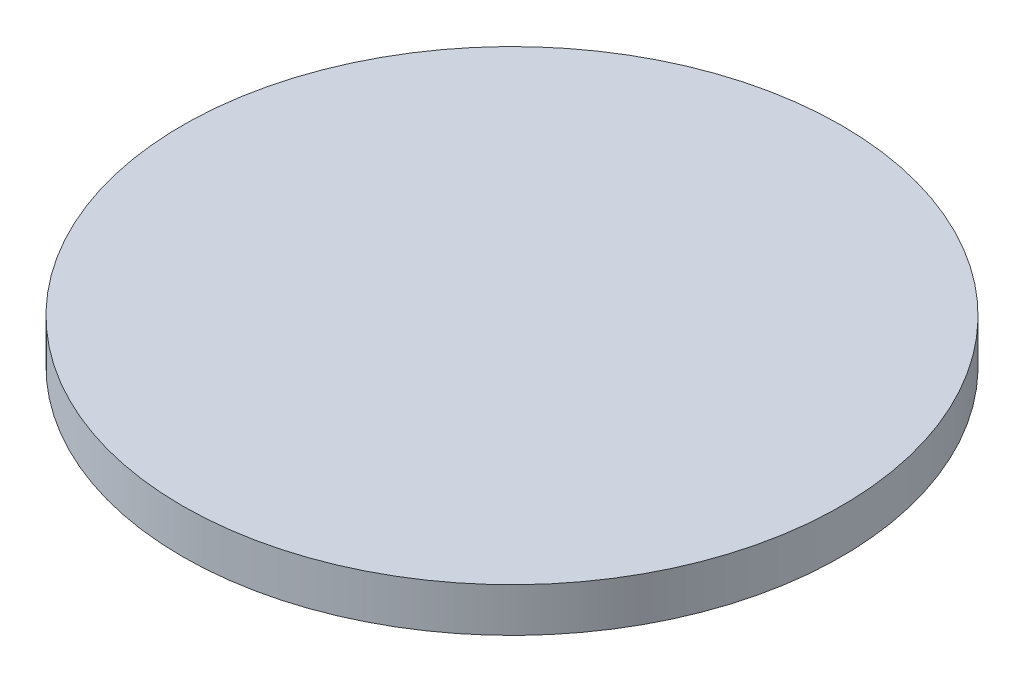
from build123d import *

# Parameters (mm, degrees)
CROQUIS3_R              = 225
SALIENTE_EXTRUIR2_DEPTH = 30
CROQUIS5_R              = 208.091282864
CORTAR_EXTRUIR1_DEPTH   = 20


with BuildPart() as part:
    # Croquis3 → Saliente-Extruir2 (new body)
    with BuildSketch(Plane(origin=(0, 0, 0), x_dir=(1, 0, 0), z_dir=(0, 1, 0))):
        with Locations(Location((0, 0, 0), (0, 0, 270))):
            Circle(CROQUIS3_R)
    extrude(amount=SALIENTE_EXTRUIR2_DEPTH)

    # Croquis5 → Cortar-Extruir1 (cut)
    with BuildSketch(Plane.XZ):
        with Locations(Location((0, 0, 0), (0, 0, 270))):
            Circle(CROQUIS5_R)
    extrude(amount=-CORTAR_EXTRUIR1_DEPTH, mode=Mode.SUBTRACT)


solid = part.part
